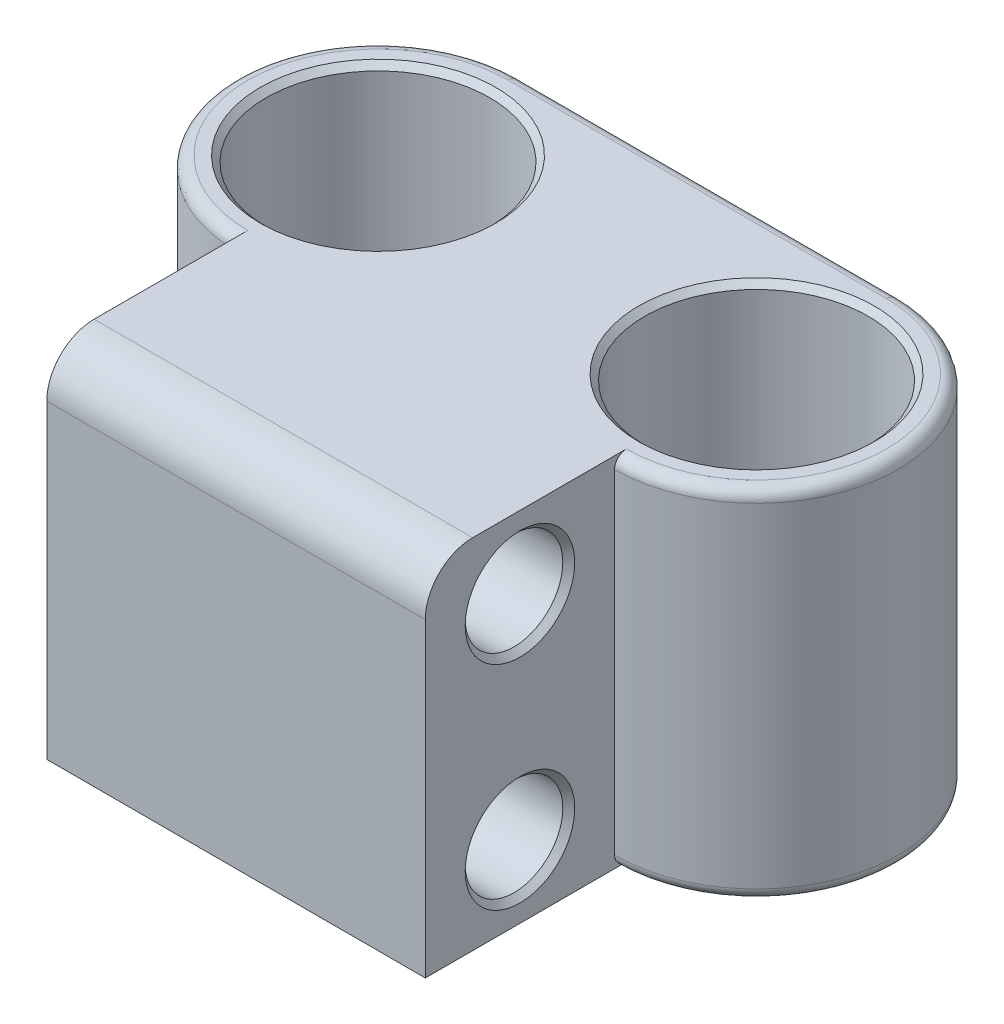
from build123d import *

# Parameters (mm, degrees)
SKETCH1_R           = 7.5
BOSS_EXTRUDE1_DEPTH = 24
CHAMFER1_SIZE       = 0.4
FILLET2_R           = 3.175
SKETCH2_R           = 3.275
CUT_EXTRUDE1_DEPTH  = 50.405623415
CHAMFER2_SIZE       = 0.4
FILLET3_R           = 0.79375


with BuildPart() as part:
    # Sketch1 → Boss-Extrude1 (new body)
    with BuildSketch(Plane(origin=(0, 0, 0), x_dir=(1, 0, 0), z_dir=(0, 1, 0))):
        with BuildLine():
            Line((12.7, -6.35), (-12.7, -6.35))
            Line((-12.7, -6.35), (-12.7, 6.35))
            ThreePointArc((-12.7, 6.35), (-22.225, 15.875), (-12.7, 25.4))
            Line((-12.7, 25.4), (12.7, 25.4))
            ThreePointArc((12.7, 25.4), (22.225, 15.875), (12.7, 6.35))
            Line((12.7, 6.35), (12.7, -6.35))
        make_face()
        with Locations(Location((-12.7, 15.875, 0), (0, 0, 270))):
            Circle(SKETCH1_R, mode=Mode.SUBTRACT)
        with Locations(Location((12.7, 15.875, 0), (0, 0, 90))):
            Circle(SKETCH1_R, mode=Mode.SUBTRACT)
    extrude(amount=BOSS_EXTRUDE1_DEPTH)

    # Chamfer1
    chamfer1_edges = [part.edges().sort_by_distance(p)[0] for p in [
        (-12.7, 0, -23.375),
        (-12.7, 24, -23.375),
        (12.7, 0, -8.375),
        (12.7, 24, -8.375),
    ]]
    chamfer(chamfer1_edges, length=CHAMFER1_SIZE)

    # Fillet2
    fillet2_edges = [part.edges().sort_by_distance(p)[0] for p in [
        (0, 24, 6.35),
    ]]
    fillet(fillet2_edges, radius=FILLET2_R)

    # Sketch2 → Cut-Extrude1 (cut, through all)
    with BuildSketch(Plane(origin=(12.7, 0, 0), x_dir=(0, 0, -1), z_dir=(1, 0, 0))):
        with Locations((0, 19.14375)):
            Circle(SKETCH2_R)
        with Locations((0, 4.85625)):
            Circle(SKETCH2_R)
    extrude(amount=-CUT_EXTRUDE1_DEPTH, mode=Mode.SUBTRACT)

    # Chamfer2
    chamfer2_edges = [part.edges().sort_by_distance(p)[0] for p in [
        (-12.7, 19.14375, 3.275),
        (12.7, 19.14375, 3.275),
        (-12.7, 4.85625, 3.275),
        (12.7, 4.85625, 3.275),
    ]]
    chamfer(chamfer2_edges, length=CHAMFER2_SIZE)

    # Fillet3
    fillet3_edges = [part.edges().sort_by_distance(p)[0] for p in [
        (22.225, 24, -15.875),
        (0, 24, -25.4),
        (-22.225, 24, -15.875),
        (0, 0, -25.4),
        (22.225, 0, -15.875),
        (-22.225, 0, -15.875),
    ]]
    fillet(fillet3_edges, radius=FILLET3_R)


solid = part.part
